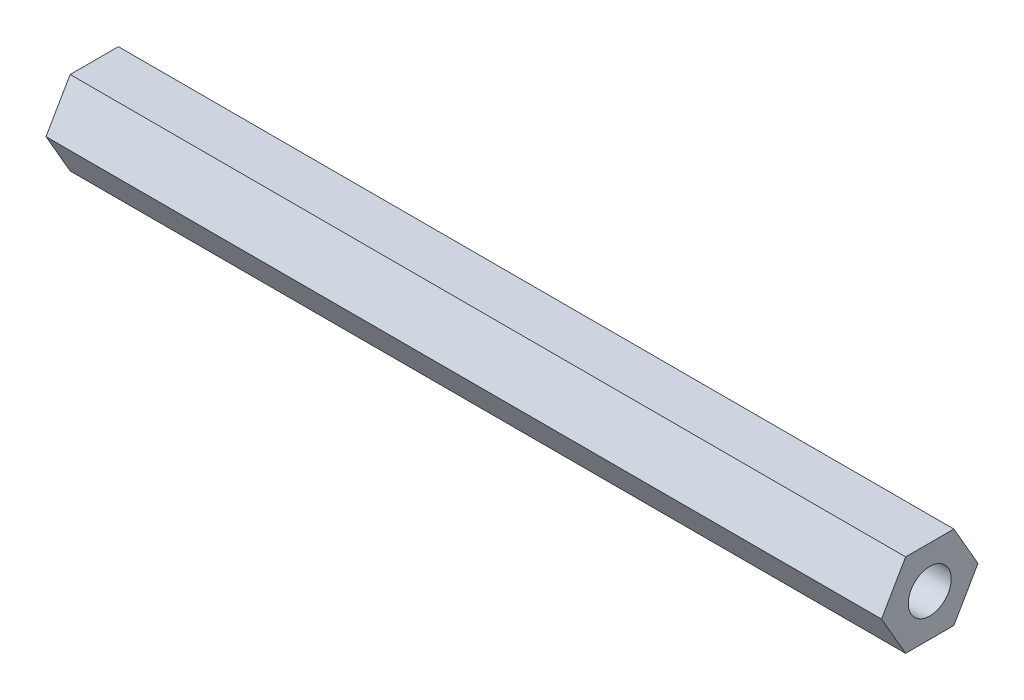
from build123d import *

# Parameters (mm, degrees)
BOSS_EXTRUDE1_DEPTH = 127
SKETCH2_R           = 3.2639
CUT_EXTRUDE1_DEPTH  = 6.35


with BuildPart() as part:
    # Sketch1 → Boss-Extrude1 (new body)
    with BuildSketch(Plane(origin=(0, 0, 0), x_dir=(0, 0, -1), z_dir=(1, 0, 0))):
        Polygon((-3.666174209, 6.35), (-7.332348419, 0), (-3.666174209, -6.35), (3.666174209, -6.35), (7.332348419, 0), (3.666174209, 6.35), align=None)
    extrude(amount=BOSS_EXTRUDE1_DEPTH)

    # Sketch2 → Cut-Extrude1 (cut)
    with BuildSketch(Plane(origin=(127, 0, 0), x_dir=(0, 0, -1), z_dir=(1, 0, 0))):
        Circle(SKETCH2_R)
    extrude(amount=-CUT_EXTRUDE1_DEPTH, mode=Mode.SUBTRACT)


solid = part.part
